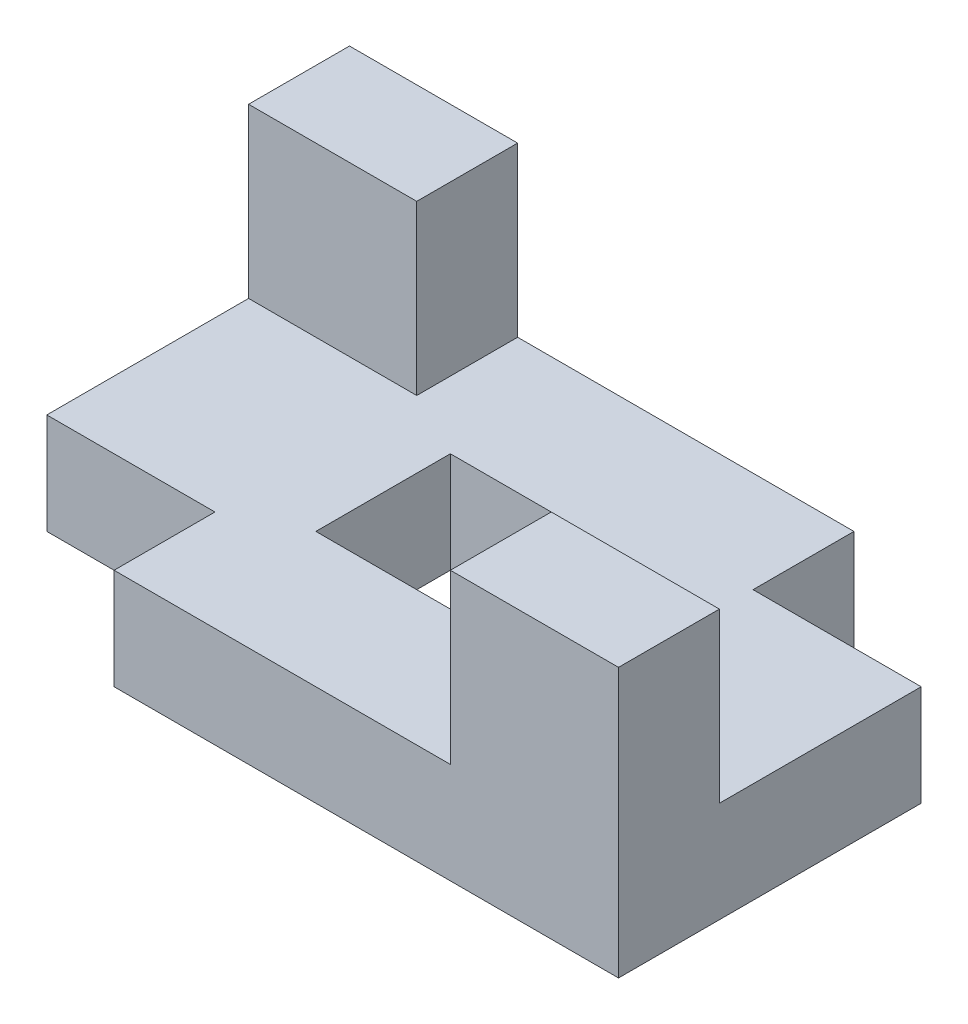
from build123d import *

# Parameters (mm, degrees)
SKETCH1_W           = 100
SKETCH1_H           = 60
BOSS_EXTRUDE1_DEPTH = 15
SKETCH2_W           = 25
SKETCH2_H           = 15
BOSS_EXTRUDE2_DEPTH = 25
SKETCH2_3_W         = 25
SKETCH2_3_H         = 15
BOSS_EXTRUDE3_DEPTH = 25
SKETCH2_4_W         = 25
SKETCH2_4_H         = 15
CUT_EXTRUDE1_DEPTH  = 25
SKETCH2_5_W         = 25
SKETCH2_5_H         = 15
CUT_EXTRUDE2_DEPTH  = 25
SKETCH4_W           = 30
SKETCH4_H           = 20
CUT_EXTRUDE3_DEPTH  = 25


with BuildPart() as part:
    # Sketch1 → Boss-Extrude1 (new body)
    with BuildSketch(Plane(origin=(0, 0, 0), x_dir=(1, 0, 0), z_dir=(0, 1, 0))):
        Rectangle(SKETCH1_W, SKETCH1_H)
    extrude(amount=BOSS_EXTRUDE1_DEPTH)

    # Sketch2 → Boss-Extrude2 (add)
    with BuildSketch(Plane(origin=(0, 15, 0), x_dir=(1, 0, 0), z_dir=(0, 1, 0))):
        with Locations((-37.5, 22.5)):
            Rectangle(SKETCH2_W, SKETCH2_H)
    extrude(amount=BOSS_EXTRUDE2_DEPTH)

    # Sketch2<3> → Boss-Extrude3 (add)
    with BuildSketch(Plane(origin=(0, 15, 0), x_dir=(1, 0, 0), z_dir=(0, 1, 0))):
        with Locations((37.5, -22.5)):
            Rectangle(SKETCH2_3_W, SKETCH2_3_H)
    extrude(amount=BOSS_EXTRUDE3_DEPTH)

    # Sketch2<4> → Cut-Extrude1 (cut)
    with BuildSketch(Plane(origin=(0, 15, 0), x_dir=(1, 0, 0), z_dir=(0, 1, 0))):
        with Locations((-37.5, -22.5)):
            Rectangle(SKETCH2_4_W, SKETCH2_4_H)
    extrude(amount=-CUT_EXTRUDE1_DEPTH, mode=Mode.SUBTRACT)

    # Sketch2<5> → Cut-Extrude2 (cut)
    with BuildSketch(Plane(origin=(0, 15, 0), x_dir=(1, 0, 0), z_dir=(0, 1, 0))):
        with Locations((37.5, 22.5)):
            Rectangle(SKETCH2_5_W, SKETCH2_5_H)
    extrude(amount=-CUT_EXTRUDE2_DEPTH, mode=Mode.SUBTRACT)

    # Sketch4 → Cut-Extrude3 (cut)
    with BuildSketch(Plane(origin=(0, 15, 0), x_dir=(1, 0, 0), z_dir=(0, 1, 0))):
        Rectangle(SKETCH4_W, SKETCH4_H)
    extrude(amount=-CUT_EXTRUDE3_DEPTH, mode=Mode.SUBTRACT)


solid = part.part
